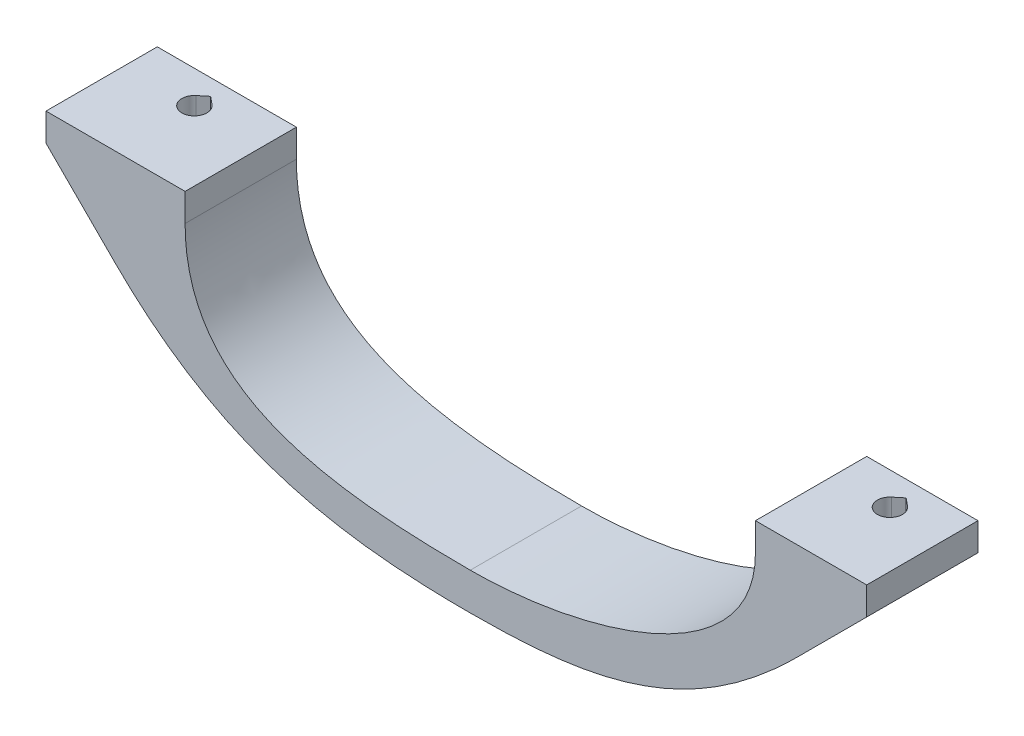
from build123d import *

# Parameters (mm, degrees)
BOSS_EXTRUDE1_DEPTH = 12
SKETCH2_R           = 1.35
CUT_EXTRUDE1_DEPTH  = 93.478375985
SKETCH4_R           = 2.5
CUT_EXTRUDE3_DEPTH  = 37
CUT_EXTRUDE4_DEPTH  = 93.478375985
CUT_EXTRUDE5_DEPTH  = 93.478375985


with BuildPart() as part:
    # Sketch1 → Boss-Extrude1 (new body)
    with BuildSketch(Plane.XY):
        with BuildLine():
            Line((88.5, -40), (76.5, -40))
            Line((76.5, -40), (76.5, -43))
            add(Edge.make_bspline(
                [(76.5, -43), (76.5, -54.661574252), (58.353185223, -60), (45.75, -60)],
                knots=[0, 0, 0, 0, 1, 1, 1, 1], degree=3))
            add(Edge.make_bspline(
                [(15, -43), (15, -57.889510146), (29.668022887, -60), (45.75, -60)],
                knots=[0, 0, 0, 0, 1, 1, 1, 1], degree=3))
            Line((15, -43), (15, -40))
            Line((15, -40), (0, -40))
            Line((0, -40), (0, -43))
            Line((0, -43), (7.5, -50.5))
            add(Edge.make_bspline(
                [(7.5, -50.5), (19.073181247, -62.073181247), (31.728934499, -64), (45.75, -64)],
                knots=[0, 0, 0, 0, 1, 1, 1, 1], degree=3))
            add(Edge.make_bspline(
                [(81, -50.5), (69.44210318, -62.05789682), (59.019901197, -64), (45.75, -64)],
                knots=[0, 0, 0, 0, 1, 1, 1, 1], degree=3))
            Line((81, -50.5), (88.5, -43))
            Line((88.5, -43), (88.5, -40))
        make_face()
    extrude(amount=-BOSS_EXTRUDE1_DEPTH)

    # Sketch2 → Cut-Extrude1 (cut, through all)
    with BuildSketch(Plane(origin=(0, -40, 0), x_dir=(1, 0, 0), z_dir=(0, 1, 0))):
        with Locations(Location((82.5, 8.5, 0), (0, 0, 270))):
            Circle(SKETCH2_R)
        with Locations(Location((7.5, 8.5, 0), (0, 0, 270))):
            Circle(SKETCH2_R)
    extrude(amount=-CUT_EXTRUDE1_DEPTH, mode=Mode.SUBTRACT)

    # Sketch4 → Cut-Extrude3 (cut)
    with BuildSketch(Plane(origin=(0, -80, 0), x_dir=(1, 0, 0), z_dir=(0, 1, 0))):
        with Locations(Location((7.5, 8.5, 0), (0, 0, 270))):
            Circle(SKETCH4_R)
        with Locations(Location((82.5, 8.5, 0), (0, 0, 126.869897646))):
            Circle(SKETCH4_R)
    extrude(amount=CUT_EXTRUDE3_DEPTH, mode=Mode.SUBTRACT)

    # Sketch7 → Cut-Extrude4 (cut, through all)
    with BuildSketch(Plane(origin=(0, -40, 0), x_dir=(1, 0, 0), z_dir=(0, 1, 0))):
        with BuildLine():
            Line((7.5, 10.25), (8.359026502, 9.541428571))
            ThreePointArc((8.359026502, 9.541428571), (7.5, 9.85), (6.640973498, 9.541428571))
            Line((6.640973498, 9.541428571), (7.5, 10.25))
        make_face()
    extrude(amount=-CUT_EXTRUDE4_DEPTH, mode=Mode.SUBTRACT)

    # Sketch8 → Cut-Extrude5 (cut, through all)
    with BuildSketch(Plane(origin=(0, -40, 0), x_dir=(1, 0, 0), z_dir=(0, 1, 0))):
        with BuildLine():
            Line((82.5, 10.25), (83.359026502, 9.541428571))
            ThreePointArc((83.359026502, 9.541428571), (82.5, 9.85), (81.640973498, 9.541428571))
            Line((81.640973498, 9.541428571), (82.5, 10.25))
        make_face()
    extrude(amount=-CUT_EXTRUDE5_DEPTH, mode=Mode.SUBTRACT)


solid = part.part
